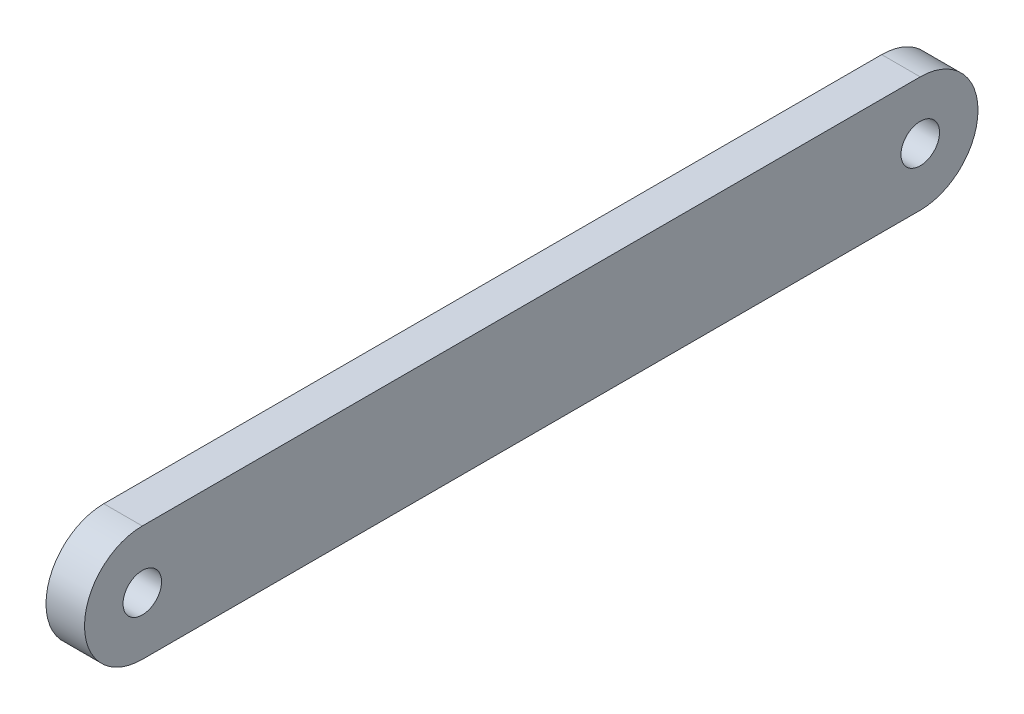
from build123d import *

# Parameters (mm, degrees)
SKETCH1_R           = 2.4
BOSS_EXTRUDE1_DEPTH = 5
SCALE1_SCALE        = 0.8
SKETCH2_R           = 2
CUT_EXTRUDE1_DEPTH  = 47.561786907
SKETCH4_R           = 2
BOSS_EXTRUDE2_DEPTH = 4
BOSS_EXTRUDE3_DEPTH = 4
SKETCH7_R           = 2
CUT_EXTRUDE2_DEPTH  = 48.334629336


with BuildPart() as part:
    # Sketch1 → Boss-Extrude1 (new body)
    with BuildSketch(Plane(origin=(0, 0, 0), x_dir=(0, 0, -1), z_dir=(1, 0, 0))):
        with BuildLine():
            Line((-50, 7.5), (50, 7.5))
            ThreePointArc((50, 7.5), (57.5, 0), (50, -7.5))
            Line((50, -7.5), (-50, -7.5))
            ThreePointArc((-50, -7.5), (-57.5, 0), (-50, 7.5))
        make_face()
        with Locations((-50, 0)):
            Circle(SKETCH1_R, mode=Mode.SUBTRACT)
        with Locations((50, 0)):
            Circle(SKETCH1_R, mode=Mode.SUBTRACT)
    extrude(amount=BOSS_EXTRUDE1_DEPTH)


with BuildPart() as part_1:
    # Scale1: scaled about (2.5, 0, 0)
    add(part.part.scale(SCALE1_SCALE).moved(Location((0.5, 0, 0))))

    # Sketch2 → Cut-Extrude1 (cut, through all)
    with BuildSketch(Plane(origin=(4.5, 0, 0), x_dir=(0, 0, -1), z_dir=(1, 0, 0))):
        with Locations((-40, 0)):
            Circle(SKETCH2_R)
        with Locations((40, 0)):
            Circle(SKETCH2_R)
    extrude(amount=-CUT_EXTRUDE1_DEPTH, mode=Mode.SUBTRACT)

    # Sketch4 → Boss-Extrude2 (add, through all)
    with BuildSketch(Plane.ZY.offset(-0.5)):
        with Locations((-40, 0)):
            Circle(SKETCH4_R)
    extrude(amount=-BOSS_EXTRUDE2_DEPTH)

    # Sketch6 → Boss-Extrude3 (add, through all)
    with BuildSketch(Plane.ZY.offset(-0.5)):
        with BuildLine():
            Line((-40.78212409, -6), (-33.634711985, -6))
            Line((-33.634711985, -6), (-33.634711985, 6))
            Line((-33.634711985, 6), (-40.78212409, 6))
            ThreePointArc((-40.78212409, 6), (-46.78212409, 0), (-40.78212409, -6))
        make_face()
    extrude(amount=-BOSS_EXTRUDE3_DEPTH)

    # Sketch7 → Cut-Extrude2 (cut, through all)
    with BuildSketch(Plane.ZY.offset(-0.5)):
        with Locations((-40.78760592, 0)):
            Circle(SKETCH7_R)
    extrude(amount=-CUT_EXTRUDE2_DEPTH, mode=Mode.SUBTRACT)


solid = part_1.part
